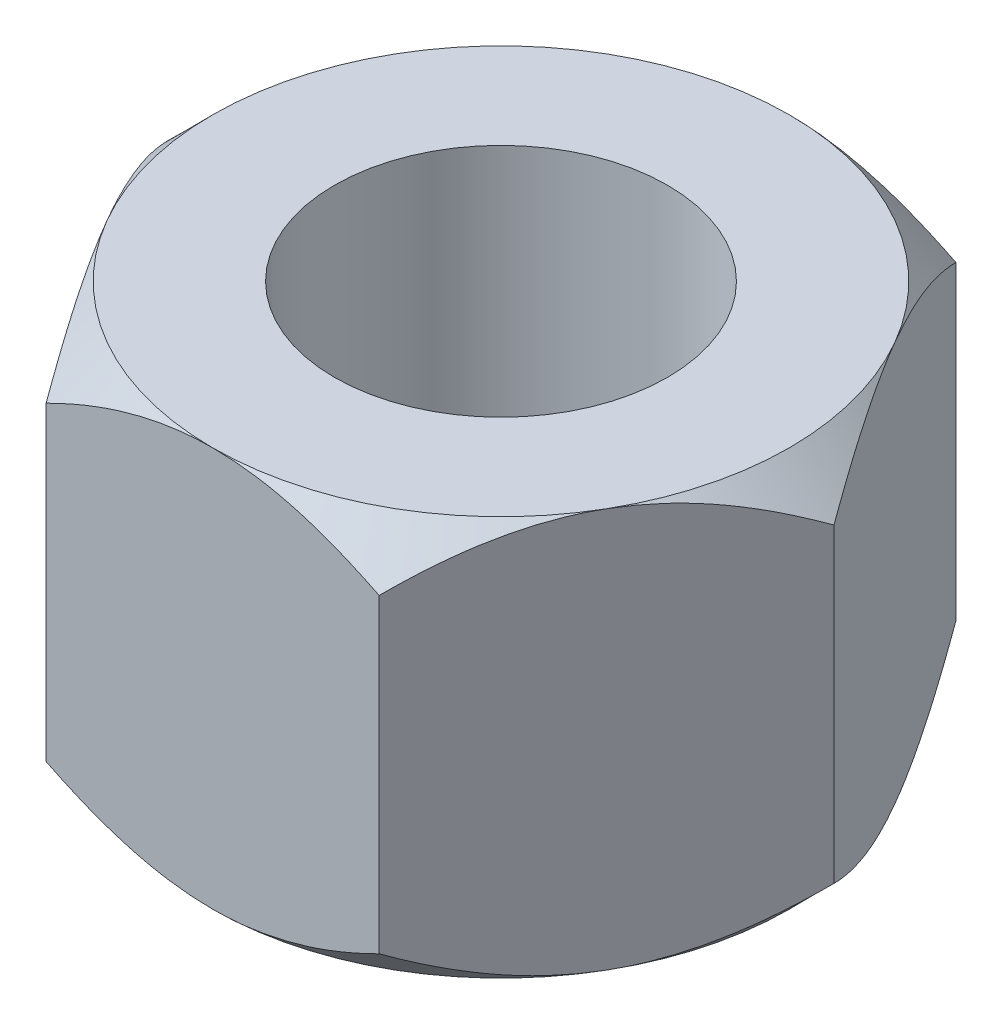
from build123d import *

# Parameters (mm, degrees)
SKETCH1_R           = 1.25
BOSS_EXTRUDE1_DEPTH = 3
SKETCH2_OUTSIDE_W   = 19.382
SKETCH2_OUTSIDE_H   = 18.712
SKETCH2_OUTSIDE_R   = 2.165063509
CUT_EXTRUDE1_DEPTH  = 5.465142775
CUT_EXTRUDE1_DRAFT  = -45
SKETCH3_OUTSIDE_W   = 19.382
SKETCH3_OUTSIDE_H   = 18.712
SKETCH3_OUTSIDE_R   = 2.165063509
CUT_EXTRUDE2_DEPTH  = 5.465142775
CUT_EXTRUDE2_DRAFT  = -45


with BuildPart() as part:
    # Sketch1 → Boss-Extrude1 (new body)
    with BuildSketch(Plane(origin=(0, 0, 0), x_dir=(1, 0, 0), z_dir=(0, 1, 0))):
        Polygon((-1.25, -2.165063509), (1.25, -2.165063509), (2.5, 0), (1.25, 2.165063509), (-1.25, 2.165063509), (-2.5, 0), align=None)
        with Locations(Location((0, 0, 0), (0, 0, 270))):
            Circle(SKETCH1_R, mode=Mode.SUBTRACT)
    extrude(amount=BOSS_EXTRUDE1_DEPTH)


with BuildPart() as cut_extrude1_tool:
    # Sketch2 outside → Cut-Extrude1 (with draft: the straight prism first)
    with BuildSketch(Plane(origin=(0, 3, 0), x_dir=(1, 0, 0), z_dir=(0, 1, 0))):
        Rectangle(SKETCH2_OUTSIDE_W, SKETCH2_OUTSIDE_H)
        Circle(SKETCH2_OUTSIDE_R, mode=Mode.SUBTRACT)
    extrude(amount=-CUT_EXTRUDE1_DEPTH)
    # Cut-Extrude1: the draft: its side faces are tilted about the plane it starts from
    cut_extrude1_sides = [cut_extrude1_tool.faces().sort_by_distance(p)[0] for p in [
        (0, 0.267428613, 9.356),
        (9.691, 0.267428613, 0),
        (0, 0.267428613, -9.356),
        (-9.691, 0.267428613, 0),
        (-2.165063509, 0.267428613, 0),
    ]]
    draft(cut_extrude1_sides, Plane(origin=(0, 3, 0), x_dir=(1, 0, 0), z_dir=(0, 1, 0)), CUT_EXTRUDE1_DRAFT)


with BuildPart() as part_1:
    add(part.part)

    # Cut-Extrude1: cut by cut_extrude1_tool
    add(cut_extrude1_tool.part, mode=Mode.SUBTRACT)


with BuildPart() as cut_extrude2_tool:
    # Sketch3 outside → Cut-Extrude2 (with draft: the straight prism first)
    with BuildSketch(Plane.XZ):
        Rectangle(SKETCH3_OUTSIDE_W, SKETCH3_OUTSIDE_H)
        Circle(SKETCH3_OUTSIDE_R, mode=Mode.SUBTRACT)
    extrude(amount=-CUT_EXTRUDE2_DEPTH)
    # Cut-Extrude2: the draft: its side faces are tilted about the plane it starts from
    cut_extrude2_sides = [cut_extrude2_tool.faces().sort_by_distance(p)[0] for p in [
        (0, 2.732571387, -9.356),
        (9.691, 2.732571387, 0),
        (0, 2.732571387, 9.356),
        (-9.691, 2.732571387, 0),
        (-2.165063509, 2.732571387, 0),
    ]]
    draft(cut_extrude2_sides, Plane.XZ, CUT_EXTRUDE2_DRAFT)


with BuildPart() as part_2:
    add(part_1.part)

    # Cut-Extrude2: cut by cut_extrude2_tool
    add(cut_extrude2_tool.part, mode=Mode.SUBTRACT)


solid = part_2.part
